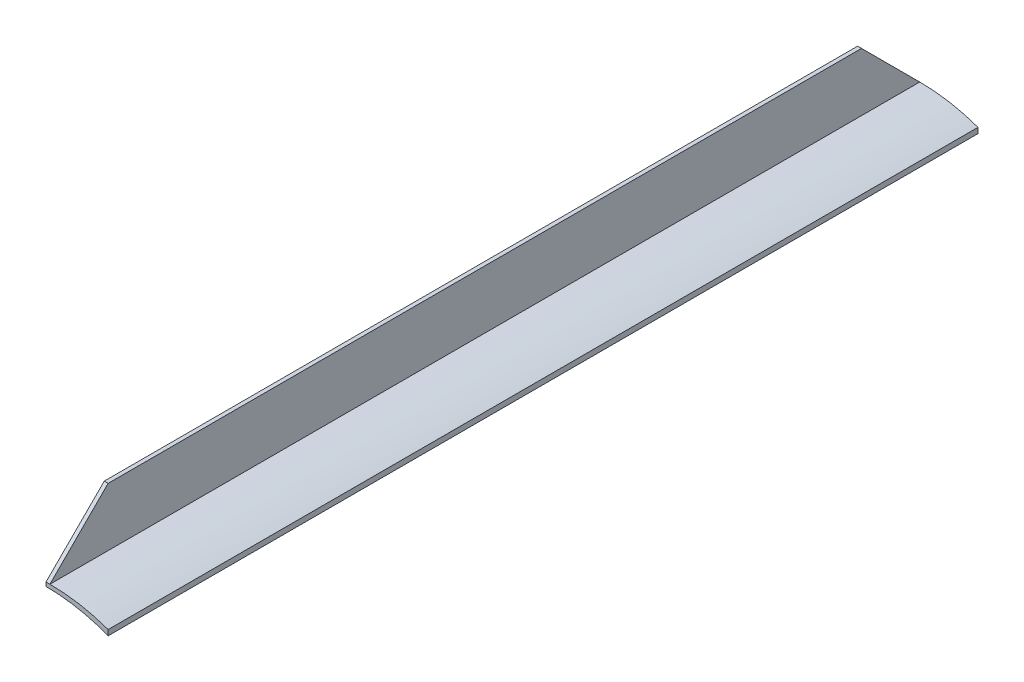
from build123d import *

# Parameters (mm, degrees)
EXTRUDE1_DEPTH = 177.8
EXTRUDE2_DEPTH = 387.35


with BuildPart() as part:
    # Sketch1 → Extrude1 (new, symmetric)
    with BuildSketch(Plane.XY):
        with BuildLine():
            Line((0, 0), (0, 25.4))
            Line((0, 25.4), (1.5875, 25.4))
            Line((1.5875, 25.4), (1.5875, 1.5875))
            ThreePointArc((1.5875, 1.5875), (13.671867582, 0.546246178), (25.4, -2.546820159))
            Line((25.4, -2.546820159), (25.4, -4.781862636))
            ThreePointArc((25.4, -4.781862636), (12.923101507, -1.205874633), (0, 0))
        make_face()
    extrude(amount=EXTRUDE1_DEPTH, both=True)

    # Sketch2 → Extrude2 (cut)
    with BuildSketch(Plane.ZY):
        Polygon((177.8, 25.4), (153.9875, 25.4), (177.8, 1.5875), align=None)
    extrude2 = extrude(amount=-EXTRUDE2_DEPTH, mode=Mode.SUBTRACT)

    # Mirror2: Extrude2 across plane
    add(extrude2.mirror(Plane(origin=(0, 0, 0), x_dir=(1, 0, 0), z_dir=(0, 0, -1))), mode=Mode.SUBTRACT)


solid = part.part
